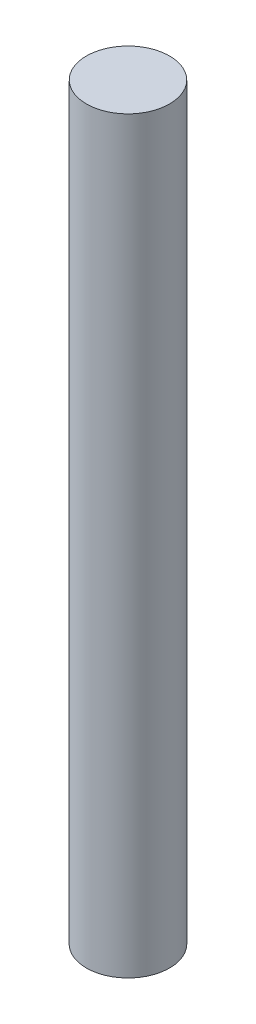
from build123d import *

# Parameters (mm, degrees)
SKETCH1_R           = 1.27
BOSS_EXTRUDE1_DEPTH = 22.86


with BuildPart() as part:
    # Sketch1 → Boss-Extrude1 (new body)
    with BuildSketch(Plane(origin=(0, 0, 0), x_dir=(1, 0, 0), z_dir=(0, 1, 0))):
        with Locations(Location((0, 0, 0), (0, 0, 270))):
            Circle(SKETCH1_R)
    extrude(amount=BOSS_EXTRUDE1_DEPTH)


solid = part.part
